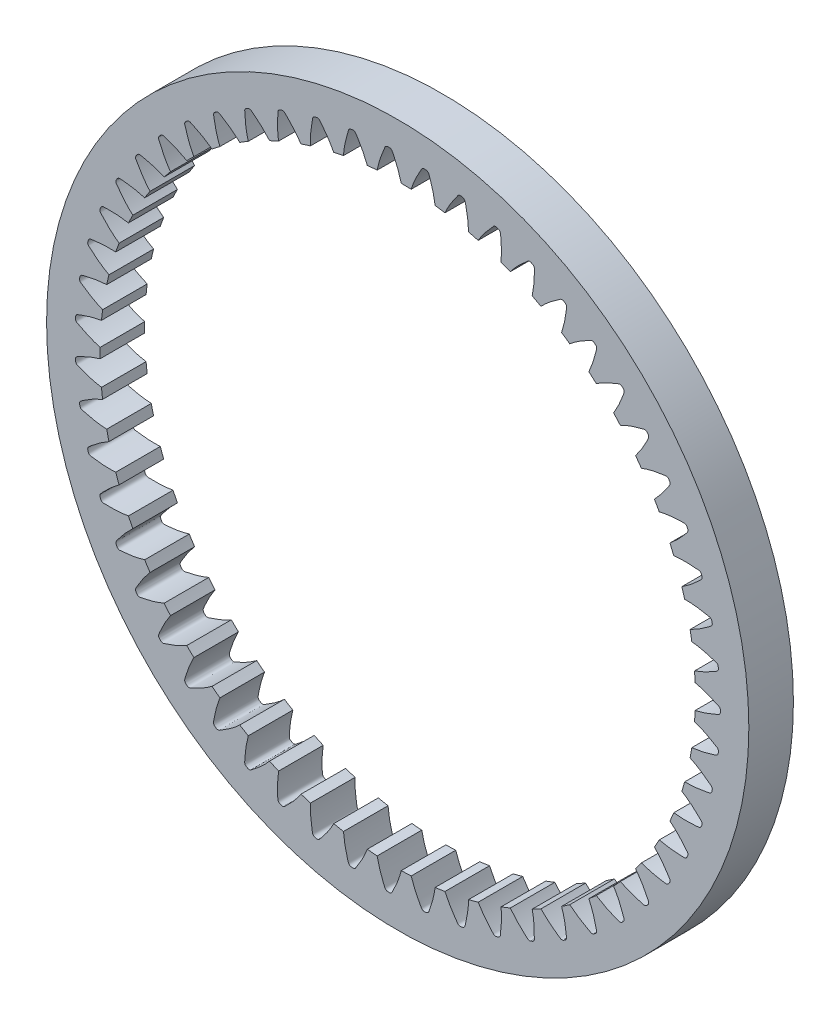
from build123d import *

# Parameters (mm, degrees)
SKETCHREVOLVESPURGEAR_W       = 4
SKETCHREVOLVESPURGEAR_H       = 4.799999985
TOOTHEXTRUDECUTSPURGEAR_DEPTH = 2
PATTERNSPURGEAR_COUNT         = 55


with BuildPart() as part:
    # SketchRevolveSpurGear → SpurGear (revolve)
    with BuildSketch(Plane(origin=(0, 0, 0), x_dir=(0, 0, -1), z_dir=(1, 0, 0))):
        with Locations((0, 29.099999595)):
            Rectangle(SKETCHREVOLVESPURGEAR_W, SKETCHREVOLVESPURGEAR_H)
    revolve(axis=Axis((0, 0, 0), (0, 0, -1)))

    # SketchToothSpurGear → ToothExtrudeCutSpurGear (cut, symmetric)
    with BuildSketch(Plane.XY):
        with BuildLine():
            ThreePointArc((26.661143645, -1.084352278), (26.683185723, 0), (26.661143645, 1.084352278))
            add(Edge.make_bspline(
                [(26.661143645, 1.084352278), (26.771290932, 1.060729715), (26.942432435, 1.019513731), (27.177626463, 0.954455679), (27.372992959, 0.895487945), (27.580268016, 0.827614446), (27.799153728, 0.750289731), (28.029240353, 0.662776702), (28.270468231, 0.565171604), (28.521257548, 0.454250779), (28.706807509, 0.374356526), (28.81694733, 0.315508201), (28.850580128, 0.289068648), (28.880055853, 0.258815186), (28.904962557, 0.224651266), (28.924808622, 0.187345426), (28.944073727, 0.134927799), (28.95060676, 0.082097448), (28.949865742, 0.032743292), (28.950066481, 0), (28.949865742, -0.032743292), (28.95060676, -0.082097448), (28.944073727, -0.134927799), (28.924808622, -0.187345426), (28.904962557, -0.224651266), (28.880055853, -0.258815186), (28.850580128, -0.289068648), (28.81694733, -0.315508201), (28.706807509, -0.374356526), (28.521257548, -0.454250779), (28.270468231, -0.565171604), (28.029240353, -0.662776702), (27.799153728, -0.750289731), (27.580268016, -0.827614446), (27.372992959, -0.895487945), (27.177626463, -0.954455679), (26.942432435, -1.019513731), (26.771290932, -1.060729715), (26.661143645, -1.084352278)],
                knots=[0, 0, 0, 0, 0.06368261, 0.099490553, 0.137942921, 0.179039714, 0.222780933, 0.269166577, 0.318196646, 0.36987114, 0.424190059, 0.432383721, 0.440322313, 0.448260906, 0.456199498, 0.46413809, 0.472076683, 0.487661443, 0.493830726, 0.5, 0.506169274, 0.512338557, 0.527923317, 0.53586191, 0.543800502, 0.551739094, 0.559677687, 0.567616279, 0.575809941, 0.63012886, 0.681803354, 0.730833423, 0.777219067, 0.820960286, 0.862057079, 0.900509447, 0.93631739, 1, 1, 1, 1], degree=3))
        make_face()
    toothextrudecutspurgear = extrude(amount=TOOTHEXTRUDECUTSPURGEAR_DEPTH, both=True, mode=Mode.SUBTRACT)

    # PatternSpurGear: ToothExtrudeCutSpurGear ×55 about axis
    patternspurgear_axis = Axis((0, 0, 55), (0, 0, -1))
    for i in range(1, PATTERNSPURGEAR_COUNT):
        add(toothextrudecutspurgear.rotate(patternspurgear_axis, i * 360 / PATTERNSPURGEAR_COUNT), mode=Mode.SUBTRACT)


solid = part.part
